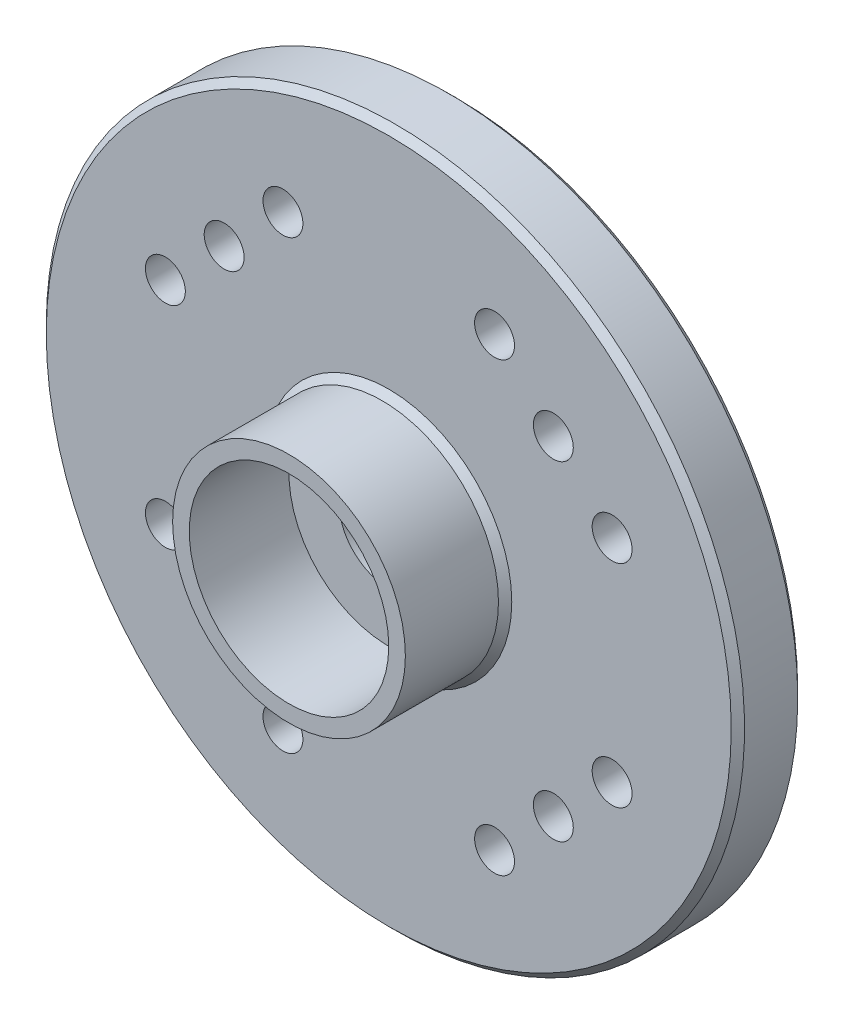
from build123d import *

# Parameters (mm, degrees)
SKETCH_1_R          = 10.5
SKETCH_1_R_2        = 1.5
EXTRUDE_1_DEPTH     = 2
SKETCH_2_R          = 3.5
SKETCH_2_R_2        = 3
EXTRUDE_2_DEPTH     = 3
SKETCH_3_R          = 3
CUT_EXTRUDE_1_DEPTH = 1
SKETCH_4_R          = 0.6
CUT_EXTRUDE_2_DEPTH = 2
CHAMFER_1_SIZE      = 0.2


with BuildPart() as part:
    # 草图1 → 凸台-拉伸1 (new body)
    with BuildSketch(Plane.XY):
        Circle(SKETCH_1_R)
        Circle(SKETCH_1_R_2, mode=Mode.SUBTRACT)
    extrude(amount=EXTRUDE_1_DEPTH)

    # 草图2 → 凸台-拉伸2 (add)
    with BuildSketch(Plane.XY.offset(2)):
        Circle(SKETCH_2_R)
        Circle(SKETCH_2_R_2, mode=Mode.SUBTRACT)
    extrude(amount=EXTRUDE_2_DEPTH)

    # 草图3 → 切除-拉伸1 (cut)
    with BuildSketch(Plane(origin=(0, 0, 0), x_dir=(-1, 0, 0), z_dir=(0, 0, -1))):
        with Locations(Location((0, 0, 0), (0, 0, 180))):
            Circle(SKETCH_3_R)
    extrude(amount=-CUT_EXTRUDE_1_DEPTH, mode=Mode.SUBTRACT)

    # 草图4 → 切除-拉伸2 (cut)
    with BuildSketch(Plane.XY.offset(2)):
        with Locations((-4.949747468, 4.949747468)):
            Circle(SKETCH_4_R)
        with Locations((4.949747468, 4.949747468)):
            Circle(SKETCH_4_R)
        with Locations((-4.949747468, -4.949747468)):
            Circle(SKETCH_4_R)
        with Locations((4.949747468, -4.949747468)):
            Circle(SKETCH_4_R)
        with Locations((-3.181980515, 6.717514421)):
            Circle(SKETCH_4_R)
        with Locations(Location((-6.717514421, 3.181980515, 0), (0, 0, 180))):
            Circle(SKETCH_4_R)
        with Locations((6.717514421, 3.181980515)):
            Circle(SKETCH_4_R)
        with Locations(Location((3.181980515, 6.717514421, 0), (0, 0, 180))):
            Circle(SKETCH_4_R)
        with Locations((3.181980515, -6.717514421)):
            Circle(SKETCH_4_R)
        with Locations(Location((6.717514421, -3.181980515, 0), (0, 0, 180))):
            Circle(SKETCH_4_R)
        with Locations((-6.717514421, -3.181980515)):
            Circle(SKETCH_4_R)
        with Locations(Location((-3.181980515, -6.717514421, 0), (0, 0, 180))):
            Circle(SKETCH_4_R)
    extrude(amount=-CUT_EXTRUDE_2_DEPTH, mode=Mode.SUBTRACT)

    # 倒角1
    chamfer_1_edges = [part.edges().sort_by_distance(p)[0] for p in [
        (-3.5, 0, 2),
        (-10.5, 0, 0),
        (-10.5, 0, 2),
    ]]
    chamfer(chamfer_1_edges, length=CHAMFER_1_SIZE)


solid = part.part
